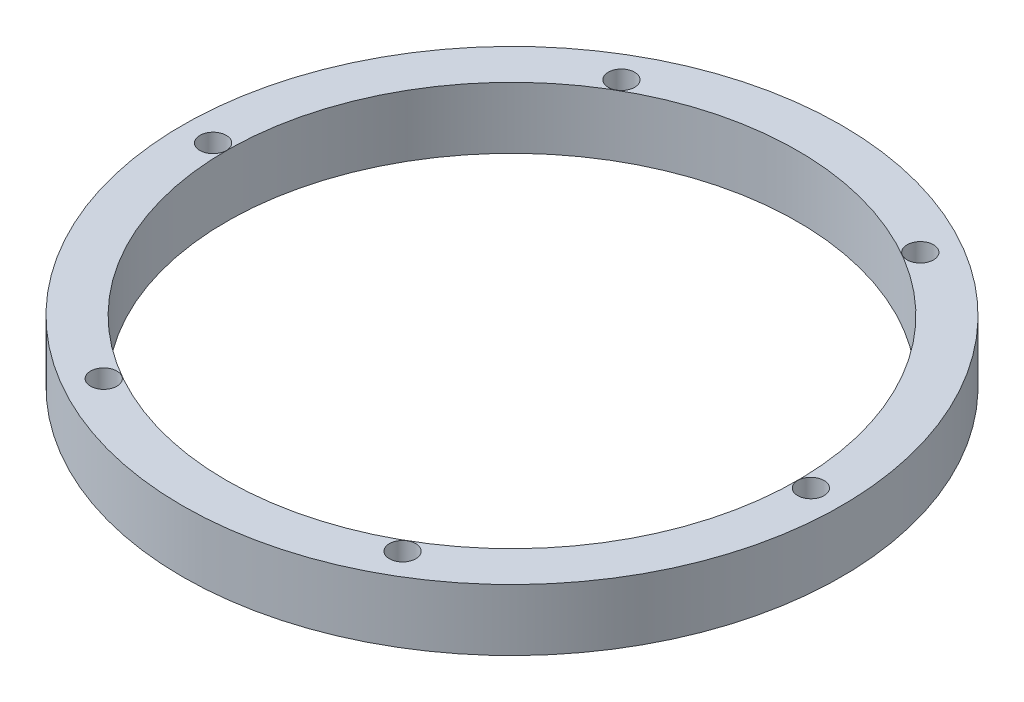
from build123d import *

# Parameters (mm, degrees)
SKETCH1_R           = 37.5
SKETCH1_R_2         = 32.5
SKETCH1_R_3         = 1.5
BOSS_EXTRUDE1_DEPTH = 7


with BuildPart() as part:
    # Sketch1 → Boss-Extrude1 (new body)
    with BuildSketch(Plane(origin=(0, 0, 0), x_dir=(1, 0, 0), z_dir=(0, 1, 0))):
        with Locations(Location((0, 0, 0), (0, 0, 270))):
            Circle(SKETCH1_R)
        with Locations(Location((0, 0, 0), (0, 0, 270))):
            Circle(SKETCH1_R_2, mode=Mode.SUBTRACT)
        with Locations(Location((17.005, -29.453523983, 0), (0, 0, 270))):
            Circle(SKETCH1_R_3, mode=Mode.SUBTRACT)
        with Locations(Location((-17.005, -29.453523983, 0), (0, 0, 270))):
            Circle(SKETCH1_R_3, mode=Mode.SUBTRACT)
        with Locations(Location((-34.01, 0, 0), (0, 0, 270))):
            Circle(SKETCH1_R_3, mode=Mode.SUBTRACT)
        with Locations(Location((-17.005, 29.453523983, 0), (0, 0, 270))):
            Circle(SKETCH1_R_3, mode=Mode.SUBTRACT)
        with Locations(Location((17.005, 29.453523983, 0), (0, 0, 270))):
            Circle(SKETCH1_R_3, mode=Mode.SUBTRACT)
        with Locations(Location((34.01, 0, 0), (0, 0, 270))):
            Circle(SKETCH1_R_3, mode=Mode.SUBTRACT)
    extrude(amount=BOSS_EXTRUDE1_DEPTH)


solid = part.part
